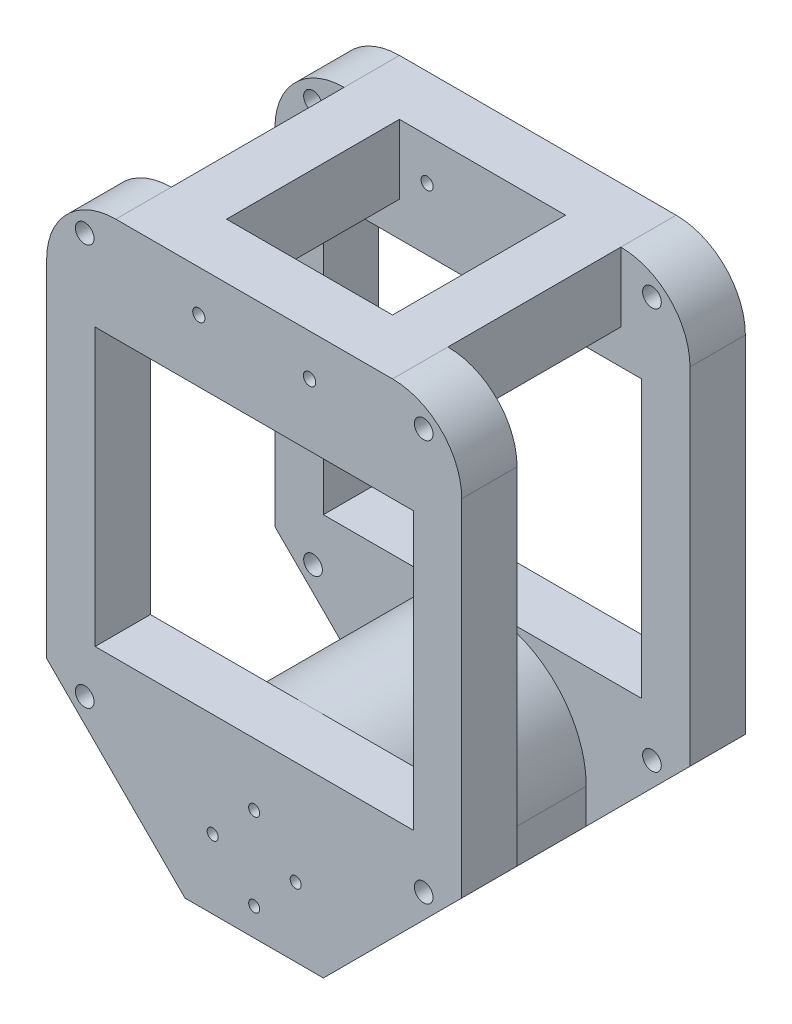
from build123d import *

# Parameters (mm, degrees)
SKETCH1_R           = 0.883567379
SKETCH1_R_2         = 0.896609669
SKETCH1_R_3         = 0.8
SKETCH1_R_4         = 1.35
BOSS_EXTRUDE1_DEPTH = 8
SKETCH2_W           = 8
SKETCH2_H           = 10
BOSS_EXTRUDE3_DEPTH = 25
BOSS_EXTRUDE4_START = 33
SKETCH1_2_R         = 0.883567379
SKETCH1_2_R_2       = 0.896609669
SKETCH1_2_R_3       = 0.8
SKETCH1_2_R_4       = 1.35
BOSS_EXTRUDE4_DEPTH = 8
CUT_EXTRUDE1_DEPTH  = 3
CUT_EXTRUDE2_START  = 28
CUT_EXTRUDE2_DEPTH  = 3
BOSS_EXTRUDE5_DEPTH = 25
CUT_EXTRUDE3_DEPTH  = 41
FILLET5_R           = 10
SKETCH8_W           = 46
SKETCH8_H           = 40
CUT_EXTRUDE4_DEPTH  = 79.4619407


with BuildPart() as part:
    # Sketch1 → Boss-Extrude1 (new body)
    with BuildSketch(Plane.XY):
        Polygon((-30, 20.206387144), (0, 20.206387144), (30, 20.206387144), (30, -59.793612856), (-30, -59.793612856), align=None)
        with Locations((-8, 14.206387144)):
            Circle(SKETCH1_R, mode=Mode.SUBTRACT)
        with Locations((8, 14.206387144)):
            Circle(SKETCH1_R_2, mode=Mode.SUBTRACT)
        with Locations((0, -43.793612856)):
            Circle(SKETCH1_R_3, mode=Mode.SUBTRACT)
        with Locations((6, -49.793612856)):
            Circle(SKETCH1_R_3, mode=Mode.SUBTRACT)
        with Locations((0, -55.793612856)):
            Circle(SKETCH1_R_3, mode=Mode.SUBTRACT)
        with Locations((-6, -49.793612856)):
            Circle(SKETCH1_R_3, mode=Mode.SUBTRACT)
        with Locations((-24.5, 16.206387144)):
            Circle(SKETCH1_R_4, mode=Mode.SUBTRACT)
        with Locations((24.5, 16.206387144)):
            Circle(SKETCH1_R_4, mode=Mode.SUBTRACT)
        with Locations((-24.5, -41.793612856)):
            Circle(SKETCH1_R_4, mode=Mode.SUBTRACT)
        with Locations((24.5, -41.793612856)):
            Circle(SKETCH1_R_4, mode=Mode.SUBTRACT)
    extrude(amount=BOSS_EXTRUDE1_DEPTH)

    # Sketch2 → Boss-Extrude3 (add)
    with BuildSketch(Plane.XY.offset(8)):
        with Locations((-16, 15.206387144)):
            Rectangle(SKETCH2_W, SKETCH2_H)
        with Locations((16, 15.206387144)):
            Rectangle(SKETCH2_W, SKETCH2_H)
    extrude(amount=BOSS_EXTRUDE3_DEPTH)

    # Sketch1<2> → Boss-Extrude4 (add)
    with BuildSketch(Plane.XY.offset(BOSS_EXTRUDE4_START)):
        Polygon((-30, 20.206387144), (0, 20.206387144), (30, 20.206387144), (30, -59.793612856), (-30, -59.793612856), align=None)
        with Locations((-8, 14.206387144)):
            Circle(SKETCH1_2_R, mode=Mode.SUBTRACT)
        with Locations((8, 14.206387144)):
            Circle(SKETCH1_2_R_2, mode=Mode.SUBTRACT)
        with Locations((0, -43.793612856)):
            Circle(SKETCH1_2_R_3, mode=Mode.SUBTRACT)
        with Locations((6, -49.793612856)):
            Circle(SKETCH1_2_R_3, mode=Mode.SUBTRACT)
        with Locations((0, -55.793612856)):
            Circle(SKETCH1_2_R_3, mode=Mode.SUBTRACT)
        with Locations((-6, -49.793612856)):
            Circle(SKETCH1_2_R_3, mode=Mode.SUBTRACT)
        with Locations((-24.5, 16.206387144)):
            Circle(SKETCH1_2_R_4, mode=Mode.SUBTRACT)
        with Locations((24.5, 16.206387144)):
            Circle(SKETCH1_2_R_4, mode=Mode.SUBTRACT)
        with Locations((-24.5, -41.793612856)):
            Circle(SKETCH1_2_R_4, mode=Mode.SUBTRACT)
        with Locations((24.5, -41.793612856)):
            Circle(SKETCH1_2_R_4, mode=Mode.SUBTRACT)
    extrude(amount=BOSS_EXTRUDE4_DEPTH)

    # Sketch3 → Cut-Extrude1 (cut)
    with BuildSketch(Plane.XY.offset(8)):
        with BuildLine():
            Line((-10, -49.793612856), (-10, -59.793612856))
            Line((-10, -59.793612856), (10, -59.793612856))
            Line((10, -59.793612856), (10, -49.793612856))
            ThreePointArc((10, -49.793612856), (0, -39.793612856), (-10, -49.793612856))
        make_face()
    extrude(amount=-CUT_EXTRUDE1_DEPTH, mode=Mode.SUBTRACT)

    # Sketch3<2> → Cut-Extrude2 (cut)
    with BuildSketch(Plane.XY.offset(8).offset(CUT_EXTRUDE2_START)):
        with BuildLine():
            Line((-10, -49.793612856), (-10, -59.793612856))
            Line((-10, -59.793612856), (10, -59.793612856))
            Line((10, -59.793612856), (10, -49.793612856))
            ThreePointArc((10, -49.793612856), (0, -39.793612856), (-10, -49.793612856))
        make_face()
    extrude(amount=-CUT_EXTRUDE2_DEPTH, mode=Mode.SUBTRACT)

    # Sketch5 → Boss-Extrude5 (add)
    with BuildSketch(Plane(origin=(0, 0, 33), x_dir=(-1, 0, 0), z_dir=(0, 0, -1))):
        with BuildLine():
            Line((-15, -49.793612856), (-15, -59.793612856))
            Line((-15, -59.793612856), (-10, -59.793612856))
            Line((-10, -59.793612856), (-10, -49.793612856))
            ThreePointArc((-10, -49.793612856), (0, -39.793612856), (10, -49.793612856))
            Line((10, -49.793612856), (10, -59.793612856))
            Line((10, -59.793612856), (15, -59.793612856))
            Line((15, -59.793612856), (15, -49.793612856))
            ThreePointArc((15, -49.793612856), (0, -34.793612856), (-15, -49.793612856))
        make_face()
    extrude(amount=BOSS_EXTRUDE5_DEPTH)

    # Sketch7 → Cut-Extrude3 (cut)
    with BuildSketch(Plane.XY.offset(41)):
        Polygon((30, -39.793612856), (30, -59.793612856), (10, -59.793612856), align=None)
        Polygon((-30, -39.793612856), (-30, -59.793612856), (-10, -59.793612856), align=None)
    extrude(amount=-CUT_EXTRUDE3_DEPTH, mode=Mode.SUBTRACT)

    # Fillet5
    fillet5_edges = [part.edges().sort_by_distance(p)[0] for p in [
        (-30, 20.206387144, 37),
        (-30, 20.206387144, 4),
        (30, 20.206387144, 4),
        (30, 20.206387144, 37),
    ]]
    fillet(fillet5_edges, radius=FILLET5_R)

    # Sketch8 → Cut-Extrude4 (cut, through all)
    with BuildSketch(Plane.XY.offset(41)):
        with Locations((0, -14.793612856)):
            Rectangle(SKETCH8_W, SKETCH8_H)
    extrude(amount=-CUT_EXTRUDE4_DEPTH, mode=Mode.SUBTRACT)


solid = part.part
